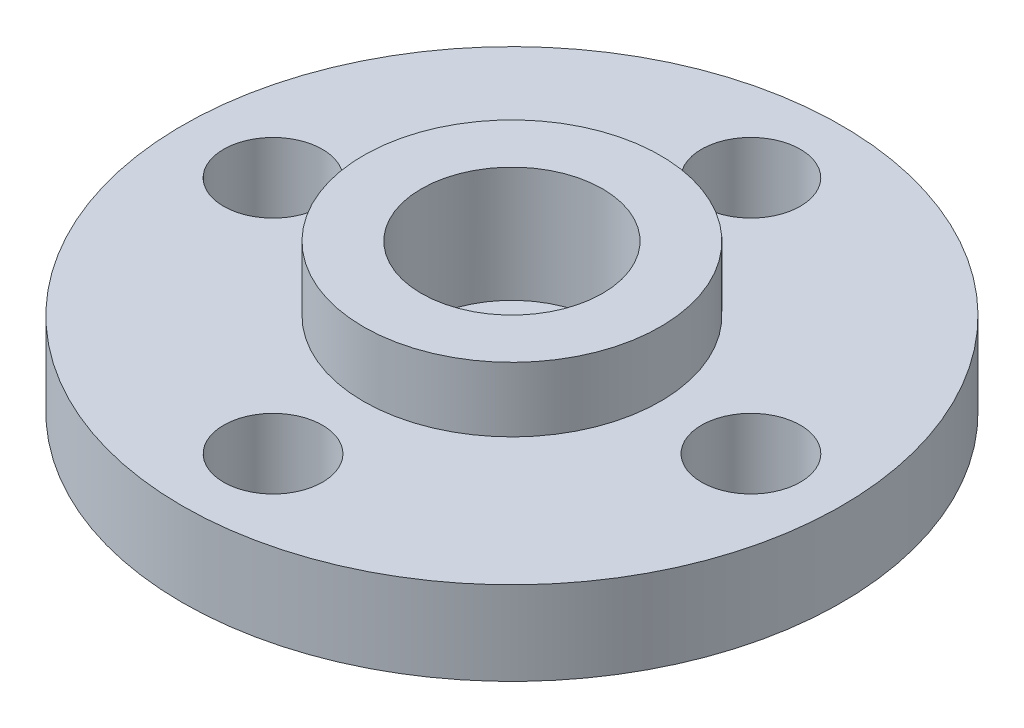
from build123d import *

# Parameters (mm, degrees)
SKETCH_2_R          = 10
SKETCH_2_R_2        = 4.505
EXTRUDE_1_DEPTH     = 2.54
SKETCH_3_R          = 4.505
SKETCH_3_R_2        = 2.75
EXTRUDE_2_DEPTH     = 4.5
SKETCH_5_R          = 1.5
CUT_EXTRUDE_1_DEPTH = 2.54
SKETCH_6_R          = 2.75
SKETCH_6_R_2        = 1.5
EXTRUDE_3_DEPTH     = 1


with BuildPart() as part:
    # 草图2 → 凸台-拉伸1 (new body)
    with BuildSketch(Plane(origin=(0, 0, 0), x_dir=(1, 0, 0), z_dir=(0, 1, 0))):
        with Locations(Location((0, 0, 0), (0, 0, 270))):
            Circle(SKETCH_2_R)
        with Locations(Location((0, 0, 0), (0, 0, 270))):
            Circle(SKETCH_2_R_2, mode=Mode.SUBTRACT)
    extrude(amount=EXTRUDE_1_DEPTH)

    # 草图3 → 凸台-拉伸2 (add)
    with BuildSketch(Plane(origin=(0, 0, 0), x_dir=(1, 0, 0), z_dir=(0, 1, 0))):
        with Locations(Location((0, 0, 0), (0, 0, 270))):
            Circle(SKETCH_3_R)
        with Locations(Location((0, 0, 0), (0, 0, 270))):
            Circle(SKETCH_3_R_2, mode=Mode.SUBTRACT)
    extrude(amount=EXTRUDE_2_DEPTH)

    # 草图5 → 切除-拉伸1 (cut)
    with BuildSketch(Plane(origin=(0, 0, 0), x_dir=(1, 0, 0), z_dir=(0, 1, 0))):
        with Locations(Location((-7.249, -0.001, 0), (0, 0, 270))):
            Circle(SKETCH_5_R)
        with Locations(Location((0, 7.25, 0), (0, 0, 270))):
            Circle(SKETCH_5_R)
        with Locations(Location((7.251, 0.001, 0), (0, 0, 270))):
            Circle(SKETCH_5_R)
        with Locations(Location((0.002, -7.25, 0), (0, 0, 270))):
            Circle(SKETCH_5_R)
    extrude(amount=CUT_EXTRUDE_1_DEPTH, mode=Mode.SUBTRACT)

    # 草图6 → 凸台-拉伸3 (add)
    with BuildSketch(Plane(origin=(0, 0, 0), x_dir=(-1, 0, 0), z_dir=(0, -1, 0))):
        with Locations(Location((0, 0, 0), (0, 0, 90))):
            Circle(SKETCH_6_R)
        with Locations(Location((0, 0, 0), (0, 0, 90))):
            Circle(SKETCH_6_R_2, mode=Mode.SUBTRACT)
    extrude(amount=-EXTRUDE_3_DEPTH)


solid = part.part
